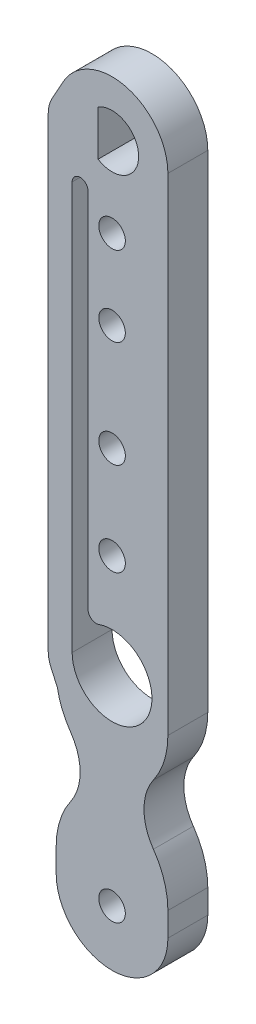
from build123d import *

# Parameters (mm, degrees)
SKETCH_1_R      = 1
EXTRUDE_1_DEPTH = 3


with BuildPart() as part:
    # 草图1 → 凸台-拉伸1 (new body)
    with BuildSketch(Plane.XY):
        with BuildLine():
            Line((-334.183039587, 54.017725717), (-334.183039587, 90.617725717))
            ThreePointArc((-334.183039587, 90.617725717), (-337.363809396, 94.692179032), (-342.088358548, 92.595252304))
            Line((-342.088358548, 92.595252304), (-342.882792815, 91.160117477))
            ThreePointArc((-342.882792815, 91.160117477), (-343.106765877, 90.598023292), (-343.183039587, 89.99777657))
            Line((-343.183039587, 89.99777657), (-343.183039587, 55.020224039))
            ThreePointArc((-343.183039587, 55.020224039), (-343.127859797, 54.508542317), (-342.964857766, 54.020389337))
            Line((-342.964857766, 54.020389337), (-342.495395341, 52.995938343))
            ThreePointArc((-342.495395341, 52.995938343), (-342.129192245, 51.728579438), (-341.494878378, 50.571881888))
            ThreePointArc((-341.494878378, 50.571881888), (-340.783039587, 48.317725717), (-341.494878378, 46.063569546))
            ThreePointArc((-341.494878378, 46.063569546), (-342.304535578, 44.424513925), (-342.583039587, 42.617725717))
            Line((-342.583039587, 42.617725717), (-342.583039587, 40.817725717))
            ThreePointArc((-342.583039587, 40.817725717), (-338.383039587, 36.617725717), (-334.183039587, 40.817725717))
            Line((-334.183039587, 40.817725717), (-334.183039587, 42.617725717))
            ThreePointArc((-334.183039587, 42.617725717), (-334.461543596, 44.424513925), (-335.271200796, 46.063569546))
            ThreePointArc((-335.271200796, 46.063569546), (-335.983039587, 48.317725717), (-335.271200796, 50.571881888))
            ThreePointArc((-335.271200796, 50.571881888), (-334.461543596, 52.21093751), (-334.183039587, 54.017725717))
        make_face()
        with Locations((-338.383039587, 84.617725717)):
            Circle(SKETCH_1_R, mode=Mode.SUBTRACT)
        with Locations((-338.383039587, 78.617725717)):
            Circle(SKETCH_1_R, mode=Mode.SUBTRACT)
        with Locations((-338.383039587, 40.817725717)):
            Circle(SKETCH_1_R, mode=Mode.SUBTRACT)
        with Locations((-338.383039587, 63.617725717)):
            Circle(SKETCH_1_R, mode=Mode.SUBTRACT)
        with Locations((-338.383039587, 70.617725717)):
            Circle(SKETCH_1_R, mode=Mode.SUBTRACT)
        with BuildLine():
            Line((-340.183039587, 59.211838267), (-340.183039587, 86.460803779))
            ThreePointArc((-340.183039587, 86.460803779), (-340.783039587, 87.060803779), (-341.383039587, 86.460803779))
            Line((-341.383039587, 86.460803779), (-341.383039587, 55.817725717))
            ThreePointArc((-341.383039587, 55.817725717), (-335.933549844, 54.08567491), (-339.383039587, 58.646152842))
            ThreePointArc((-339.383039587, 58.646152842), (-339.929449749, 58.721940318), (-340.183039587, 59.211838267))
        make_face(mode=Mode.SUBTRACT)
        with BuildLine():
            Line((-339.433039587, 90.617725717), (-339.433039587, 88.915521264))
            ThreePointArc((-339.433039587, 88.915521264), (-336.383039587, 90.617725717), (-339.433039587, 92.31993017))
            Line((-339.433039587, 92.31993017), (-339.433039587, 90.617725717))
        make_face(mode=Mode.SUBTRACT)
    extrude(amount=EXTRUDE_1_DEPTH)


solid = part.part
